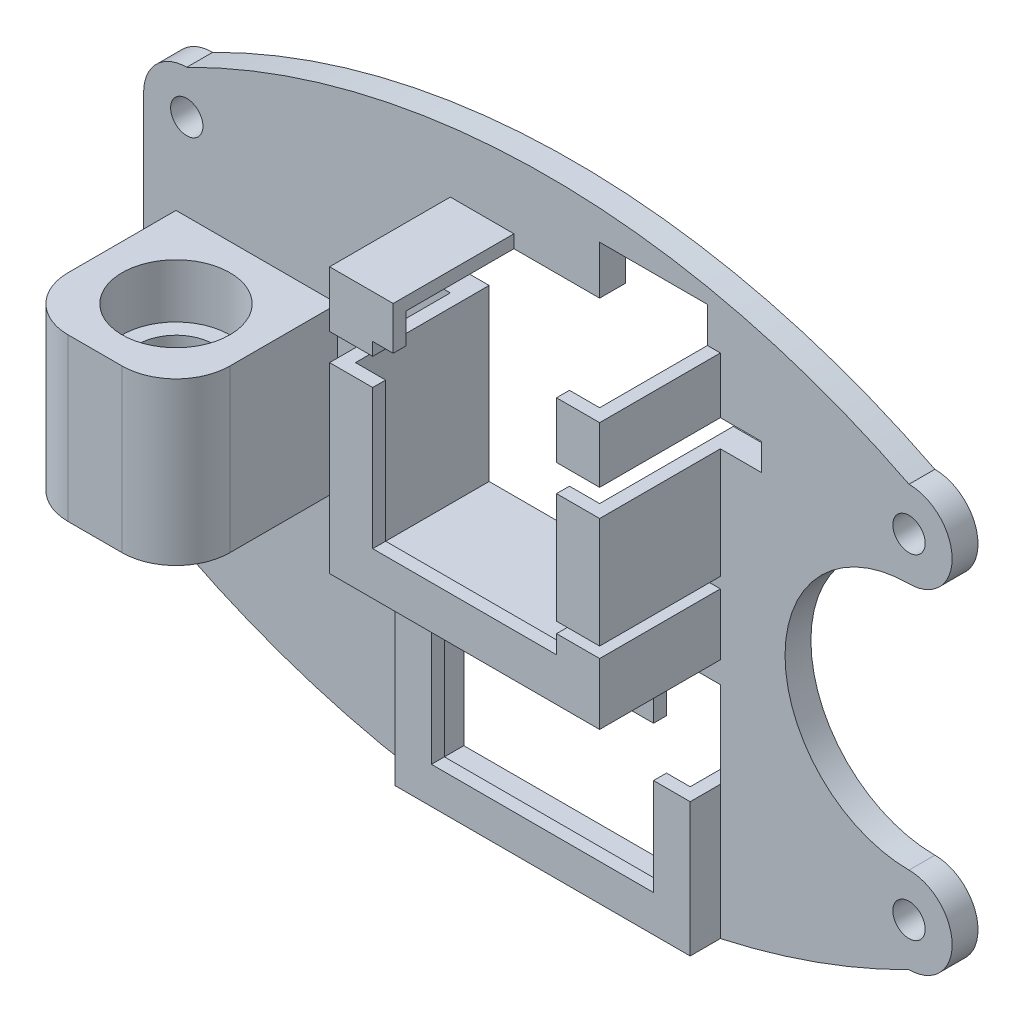
from build123d import *

# Parameters (mm, degrees)
CROQUIS1_R                 = 1.5
SALIENTE_EXTRUIR1_DEPTH    = 2.4
CROQUIS3_W                 = 25.05
CROQUIS3_H                 = 24.65
CROQUIS3_W_2               = 22.65
CROQUIS3_H_2               = 22.25
SALIENTE_EXTRUIR2_DEPTH    = 10
CROQUIS4_W                 = 25.05
CROQUIS4_H                 = 24.65
CROQUIS4_W_2               = 17.05
CROQUIS4_H_2               = 16.65
SALIENTE_EXTRUIR3_DEPTH    = 1.2
CORTAR_EXTRUIR1_START      = -11.2
CROQUIS5_W                 = 4
CROQUIS5_H                 = 2.5
CROQUIS5_W_2               = 15.15
CROQUIS5_H_2               = 4
CROQUIS5_H_3               = 1
CORTAR_EXTRUIR1_DEPTH      = 11.2
CROQUIS6_W                 = 27.4
CROQUIS6_H                 = 20.4
CROQUIS6_W_2               = 25
CROQUIS6_H_2               = 18
SALIENTE_EXTRUIR4_DEPTH    = 1.6
CROQUIS8_W                 = 15
CROQUIS8_H                 = 15
SALIENTE_EXTRUIR5_DEPTH    = 15
CROQUIS10_R                = 5
CORTAR_EXTRUIR2_DEPTH      = 5
CORTAR_EXTRUIR3_START      = -10
CROQUIS10_2_R              = 5
CORTAR_EXTRUIR3_DEPTH      = 5
CROQUIS11_R                = 3.5
CORTAR_EXTRUIR4_DEPTH      = 5
CORTAR_EXTRUIR5_DEPTH      = 2.4
CORTAR_EXTRUIR6_DEPTH      = 10
CORTAR_EXTRUIR6_DEPTH_BACK = 2.4
CROQUIS13_W                = 10
CROQUIS13_H                = 4.5
CROQUIS14_W                = 27.4
CROQUIS14_H                = 20.4
CROQUIS14_W_2              = 20.6
CROQUIS14_H_2              = 13.6
SALIENTE_EXTRUIR6_DEPTH    = 1.2
CROQUIS15_W                = 25
CROQUIS15_H                = 18
CORTAR_EXTRUIR7_DEPTH      = 2.4
CORTAR_EXTRUIR8_START      = -5.2
CROQUIS16_W                = 3.4
CROQUIS16_H                = 8
CORTAR_EXTRUIR8_DEPTH      = 5.2
REDONDEO1_R                = 5


with BuildPart() as part:
    # Croquis1 → Saliente-Extruir1 (new body)
    with BuildSketch(Plane.XY):
        with BuildLine():
            Line((-65.940699516, 48.688511327), (-65.940699516, 17.688511327))
            ThreePointArc((-65.940699516, 17.688511327), (-64.76912664, 14.860084202), (-61.940699516, 13.688511327))
            ThreePointArc((-61.940699516, 13.688511327), (-28.440699516, 5.688511327), (5.059300484, 13.688511327))
            ThreePointArc((5.059300484, 13.688511327), (9.059300484, 17.688511327), (5.059300484, 21.688511327))
            ThreePointArc((5.059300484, 21.688511327), (-6.440699516, 33.188511327), (5.059300484, 44.688511327))
            ThreePointArc((5.059300484, 44.688511327), (9.059300484, 48.688511327), (5.059300484, 52.688511327))
            ThreePointArc((5.059300484, 52.688511327), (-28.440699516, 60.688511327), (-61.940699516, 52.688511327))
            ThreePointArc((-61.940699516, 52.688511327), (-64.76912664, 51.516938452), (-65.940699516, 48.688511327))
        make_face()
        with Locations((-61.940699516, 48.688511327)):
            Circle(CROQUIS1_R, mode=Mode.SUBTRACT)
        with Locations((5.059300484, 48.688511327)):
            Circle(CROQUIS1_R, mode=Mode.SUBTRACT)
        with Locations((5.059300484, 17.688511327)):
            Circle(CROQUIS1_R, mode=Mode.SUBTRACT)
        with Locations((-61.940699516, 17.688511327)):
            Circle(CROQUIS1_R, mode=Mode.SUBTRACT)
    extrude(amount=SALIENTE_EXTRUIR1_DEPTH)

    # Croquis3 → Saliente-Extruir2 (add)
    with BuildSketch(Plane.XY.offset(2.4)):
        with Locations((-24.965699516, 42.160543548)):
            Rectangle(CROQUIS3_W, CROQUIS3_H)
        with Locations((-24.965699516, 42.160543548)):
            Rectangle(CROQUIS3_W_2, CROQUIS3_H_2, mode=Mode.SUBTRACT)
    extrude(amount=SALIENTE_EXTRUIR2_DEPTH)

    # Croquis4 → Saliente-Extruir3 (add)
    with BuildSketch(Plane.XY.offset(12.4)):
        with Locations((-24.965699516, 42.160543548)):
            Rectangle(CROQUIS4_W, CROQUIS4_H)
        with Locations((-24.965699516, 42.160543548)):
            Rectangle(CROQUIS4_W_2, CROQUIS4_H_2, mode=Mode.SUBTRACT)
    extrude(amount=SALIENTE_EXTRUIR3_DEPTH)

    # Croquis5 → Cortar-Extruir1 (cut)
    with BuildSketch(Plane.XY.offset(13.6).offset(CORTAR_EXTRUIR1_START)):
        with Locations((-35.490699516, 48.035543548)):
            Rectangle(CROQUIS5_W, CROQUIS5_H)
        with Locations((-24.015699516, 52.485543548)):
            Rectangle(CROQUIS5_W_2, CROQUIS5_H_2)
        with Locations((-14.440699516, 36.035543548)):
            Rectangle(CROQUIS5_W, CROQUIS5_H_3)
        with Locations((-14.440699516, 48.035543548)):
            Rectangle(CROQUIS5_W, CROQUIS5_H)
    extrude(amount=CORTAR_EXTRUIR1_DEPTH, mode=Mode.SUBTRACT)

    # Croquis6 → Saliente-Extruir4 (add)
    with BuildSketch(Plane.XY.offset(2.4)):
        with Locations((-26.140699516, 17.635543548)):
            Rectangle(CROQUIS6_W, CROQUIS6_H)
        with Locations((-26.140699516, 17.635543548)):
            Rectangle(CROQUIS6_W_2, CROQUIS6_H_2, mode=Mode.SUBTRACT)
    extrude(amount=SALIENTE_EXTRUIR4_DEPTH)

    # Croquis8 → Saliente-Extruir5 (add)
    with BuildSketch(Plane.XY.offset(2.4)):
        with Locations((-55.440699516, 33.188511327)):
            Rectangle(CROQUIS8_W, CROQUIS8_H)
    extrude(amount=SALIENTE_EXTRUIR5_DEPTH)

    # Croquis10 → Cortar-Extruir2 (cut)
    with BuildSketch(Plane.XZ.offset(-25.688511327)):
        with Locations(Location((-55.440699516, 9.9, 0), (0, 0, 270))):
            Circle(CROQUIS10_R)
    extrude(amount=-CORTAR_EXTRUIR2_DEPTH, mode=Mode.SUBTRACT)

    # Croquis10<2> → Cortar-Extruir3 (cut)
    with BuildSketch(Plane.XZ.offset(-25.688511327).offset(CORTAR_EXTRUIR3_START)):
        with Locations(Location((-55.440699516, 9.9, 0), (0, 0, 270))):
            Circle(CROQUIS10_2_R)
    extrude(amount=-CORTAR_EXTRUIR3_DEPTH, mode=Mode.SUBTRACT)

    # Croquis11 → Cortar-Extruir4 (cut)
    with BuildSketch(Plane.XZ.offset(-30.688511327)):
        with Locations(Location((-55.440699516, 9.9, 0), (0, 0, 270))):
            Circle(CROQUIS11_R)
    extrude(amount=-CORTAR_EXTRUIR4_DEPTH, mode=Mode.SUBTRACT)

    # Croquis12 → Cortar-Extruir5 (cut)
    with BuildSketch(Plane.XY.offset(2.4)):
        Polygon((-36.290699516, 53.285543548), (-13.640699516, 53.285543548), (-13.640699516, 49.285543548), (-8.640699516, 49.285543548), (-8.640699516, 46.785543548), (-13.640699516, 46.785543548), (-13.640699516, 31.035543548), (-36.290699516, 31.035543548), (-36.290699516, 46.785543548), (-41.290699516, 46.785543548), (-41.290699516, 49.285543548), (-36.290699516, 49.285543548), align=None)
    extrude(amount=-CORTAR_EXTRUIR5_DEPTH, mode=Mode.SUBTRACT)

    # Croquis13 → Cortar-Extruir6 (cut, two sides: drawn at the far end of the back side and taken through both)
    with BuildSketch(Plane.XY.offset(2.4).offset(-CORTAR_EXTRUIR6_DEPTH_BACK)):
        with Locations((-18.640699516, 55.535543548)):
            Rectangle(CROQUIS13_W, CROQUIS13_H)
    extrude(amount=CORTAR_EXTRUIR6_DEPTH + CORTAR_EXTRUIR6_DEPTH_BACK, mode=Mode.SUBTRACT)

    # Croquis14 → Saliente-Extruir6 (add)
    with BuildSketch(Plane.XY.offset(4)):
        with Locations((-26.140699516, 17.635543548)):
            Rectangle(CROQUIS14_W, CROQUIS14_H)
        with Locations((-26.140699516, 17.635543548)):
            Rectangle(CROQUIS14_W_2, CROQUIS14_H_2, mode=Mode.SUBTRACT)
    extrude(amount=SALIENTE_EXTRUIR6_DEPTH)

    # Croquis15 → Cortar-Extruir7 (cut)
    with BuildSketch(Plane.XY.offset(2.4)):
        with Locations((-26.140699516, 17.635543548)):
            Rectangle(CROQUIS15_W, CROQUIS15_H)
    extrude(amount=-CORTAR_EXTRUIR7_DEPTH, mode=Mode.SUBTRACT)

    # Croquis16 → Cortar-Extruir8 (cut)
    with BuildSketch(Plane.XY.offset(5.2).offset(CORTAR_EXTRUIR8_START)):
        with Locations((-14.140699516, 23.835543548)):
            Rectangle(CROQUIS16_W, CROQUIS16_H)
    extrude(amount=CORTAR_EXTRUIR8_DEPTH, mode=Mode.SUBTRACT)

    # Redondeo1
    redondeo1_edges = [part.edges().sort_by_distance(p)[0] for p in [
        (-62.940699516, 33.188511327, 17.4),
        (-47.940699516, 33.188511327, 17.4),
    ]]
    fillet(redondeo1_edges, radius=REDONDEO1_R)


solid = part.part
